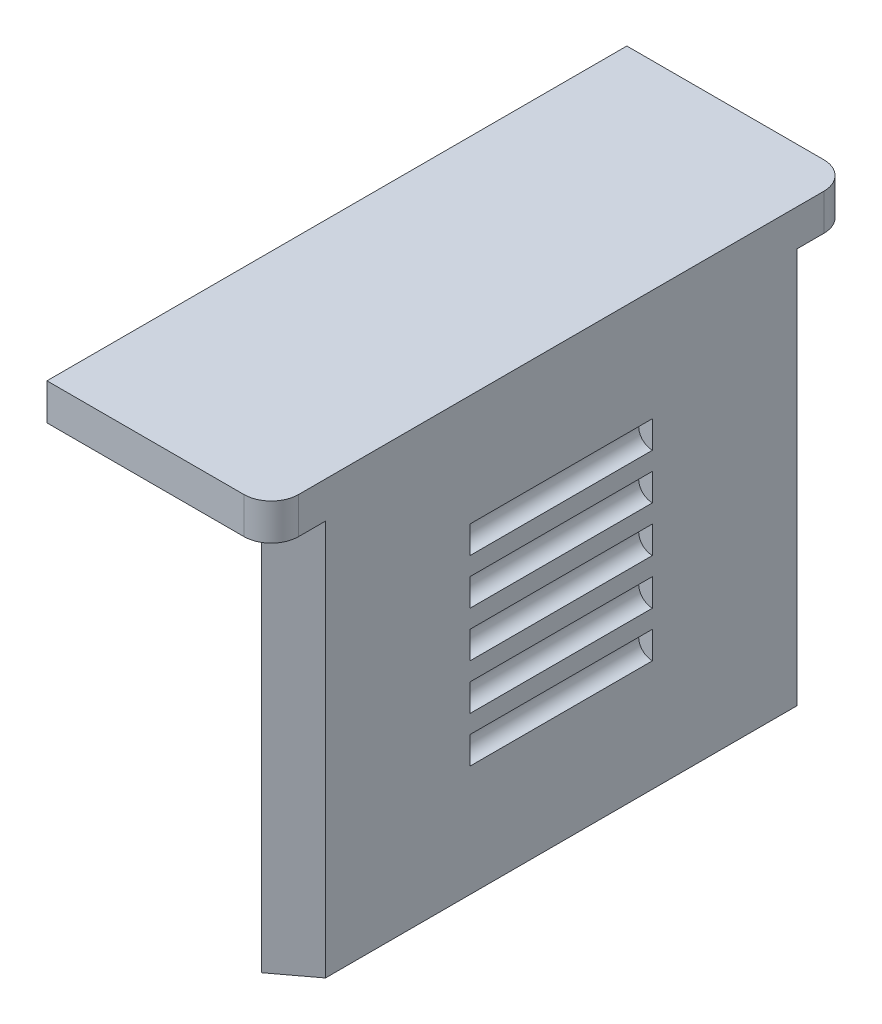
from build123d import *

# Parameters (mm, degrees)
CROQUIS1_W              = 12.3
CROQUIS1_H              = 31.8
SALIENTE_EXTRUIR1_DEPTH = 2
SALIENTE_EXTRUIR2_DEPTH = 21.7
CROQUIS5_W              = 1
CROQUIS5_H              = 15
SALIENTE_EXTRUIR4_DEPTH = 20
CROQUIS4_R              = 0.75
CORTAR_EXTRUIR1_DEPTH   = 5
REDONDEO1_R             = 1.5


with BuildPart() as part:
    # Croquis1 → Saliente-Extruir1 (new body)
    with BuildSketch(Plane(origin=(0, 111.467949425, 0), x_dir=(1, 0, 0), z_dir=(0, 1, 0))):
        with Locations((-9.802229413, -88.318391236)):
            Rectangle(CROQUIS1_W, CROQUIS1_H)
    extrude(amount=-SALIENTE_EXTRUIR1_DEPTH)

    # Croquis2 → Saliente-Extruir2 (add)
    with BuildSketch(Plane.XZ.offset(-109.467949425)):
        Polygon((-3.652229413, 101.243391236), (-5.652229413, 102.743391236), (-5.652229413, 73.893391236), (-3.652229413, 75.393391236), align=None)
    extrude(amount=SALIENTE_EXTRUIR2_DEPTH)

    # Croquis5 → Saliente-Extruir4 (add)
    with BuildSketch(Plane.XZ.offset(-109.467949425)):
        with Locations((-6.152229413, 88.318391236)):
            Rectangle(CROQUIS5_W, CROQUIS5_H)
    extrude(amount=SALIENTE_EXTRUIR4_DEPTH)

    # Croquis4 → Cortar-Extruir1 (cut, symmetric)
    with BuildSketch(Plane(origin=(0, 0, 88.318391236), x_dir=(0, -1, 0), z_dir=(0, 0, 1))):
        with Locations((-104.617949425, -3.652229413)):
            Circle(CROQUIS4_R)
        with Locations((-102.117949425, -3.652229413)):
            Circle(CROQUIS4_R)
        with Locations((-99.617949425, -3.652229413)):
            Circle(CROQUIS4_R)
        with Locations((-97.117949425, -3.652229413)):
            Circle(CROQUIS4_R)
        with Locations((-94.617949425, -3.652229413)):
            Circle(CROQUIS4_R)
    extrude(amount=CORTAR_EXTRUIR1_DEPTH, both=True, mode=Mode.SUBTRACT)

    # Redondeo1
    redondeo1_edges = [part.edges().sort_by_distance(p)[0] for p in [
        (-3.652229413, 110.467949425, 72.418391236),
        (-3.652229413, 110.467949425, 104.218391236),
    ]]
    fillet(redondeo1_edges, radius=REDONDEO1_R)


solid = part.part
